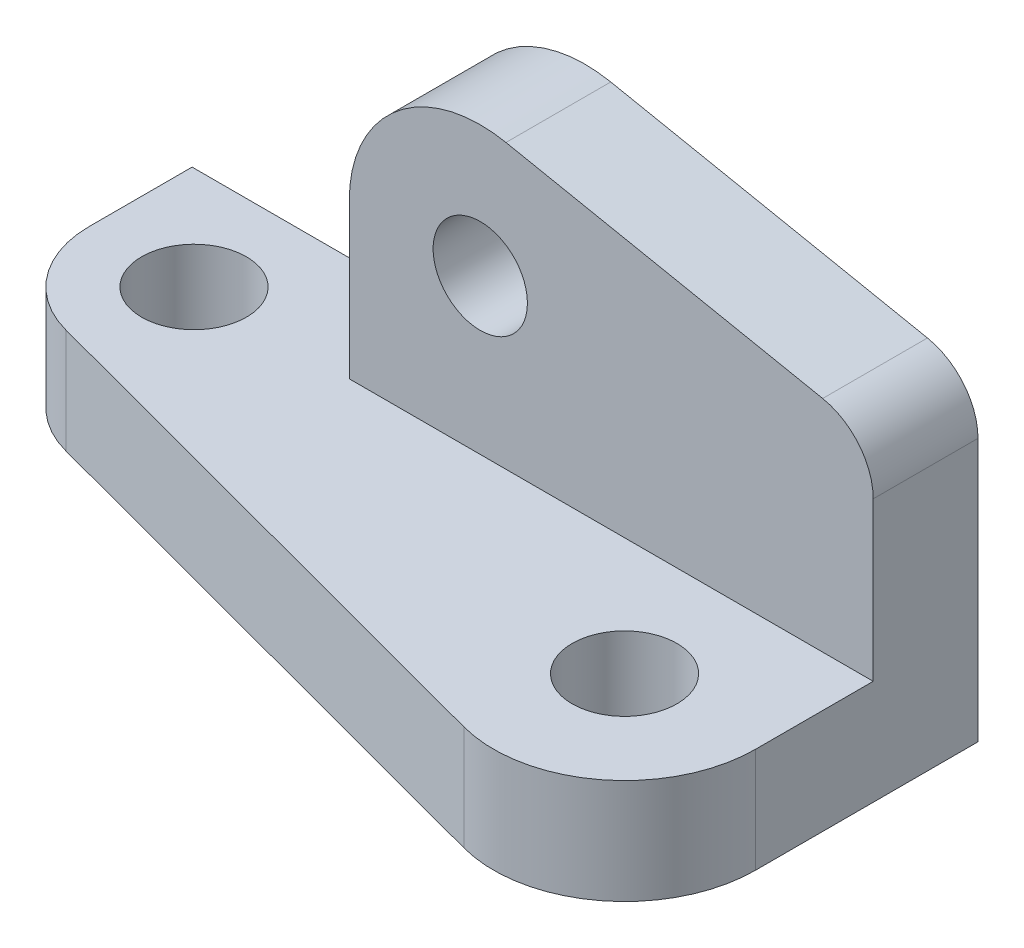
from build123d import *

# Parameters (mm, degrees)
BOSS_EXTRUDE1_DEPTH        = 20
BOSS_EXTRUDE2_DEPTH        = 20
FILLET1_R                  = 20
FILLET2_R                  = 25
FILLET3_R                  = 12
F_20_0_20_DIAMETER_HOLE1_D = 20
F_18_0_18_DIAMETER_HOLE1_D = 18


with BuildPart() as part:
    # Sketch1 → Boss-Extrude1 (new body)
    with BuildSketch(Plane(origin=(0, 0, 0), x_dir=(1, 0, 0), z_dir=(0, 1, 0))):
        Polygon((0, 0), (0, 35), (150, 35), (150, -40), align=None)
    extrude(amount=BOSS_EXTRUDE1_DEPTH)

    # Sketch2 → Boss-Extrude2 (add)
    with BuildSketch(Plane(origin=(0, 0, -35), x_dir=(-1, 0, 0), z_dir=(0, 0, -1))):
        Polygon((-150, 0), (-150, 60), (-50, 80), (-50, 0), align=None)
    extrude(amount=-BOSS_EXTRUDE2_DEPTH)

    # Fillet1
    fillet1_edges = [part.edges().sort_by_distance(p)[0] for p in [
        (0, 10, 0),
    ]]
    fillet(fillet1_edges, radius=FILLET1_R)

    # Fillet2
    fillet2_edges = [part.edges().sort_by_distance(p)[0] for p in [
        (50, 80, -25),
        (150, 10, 40),
    ]]
    fillet(fillet2_edges, radius=FILLET2_R)

    # Fillet3
    fillet3_edges = [part.edges().sort_by_distance(p)[0] for p in [
        (150, 60, -25),
    ]]
    fillet(fillet3_edges, radius=FILLET3_R)

    # Ø20.0 (20) Diameter Hole1 (through all)
    with Locations(Plane(origin=(0, 20, 0), x_dir=(1, 0, 0), z_dir=(0, 1, 0))):
        with Locations((20, 15.365566262), (125, -7.45970884)):
            Hole(F_20_0_20_DIAMETER_HOLE1_D / 2)

    # Ø18.0 (18) Diameter Hole1 (through all)
    with Locations(Plane.XY.offset(-15)):
        with Locations((75, 49.504902432)):
            Hole(F_18_0_18_DIAMETER_HOLE1_D / 2)


solid = part.part
